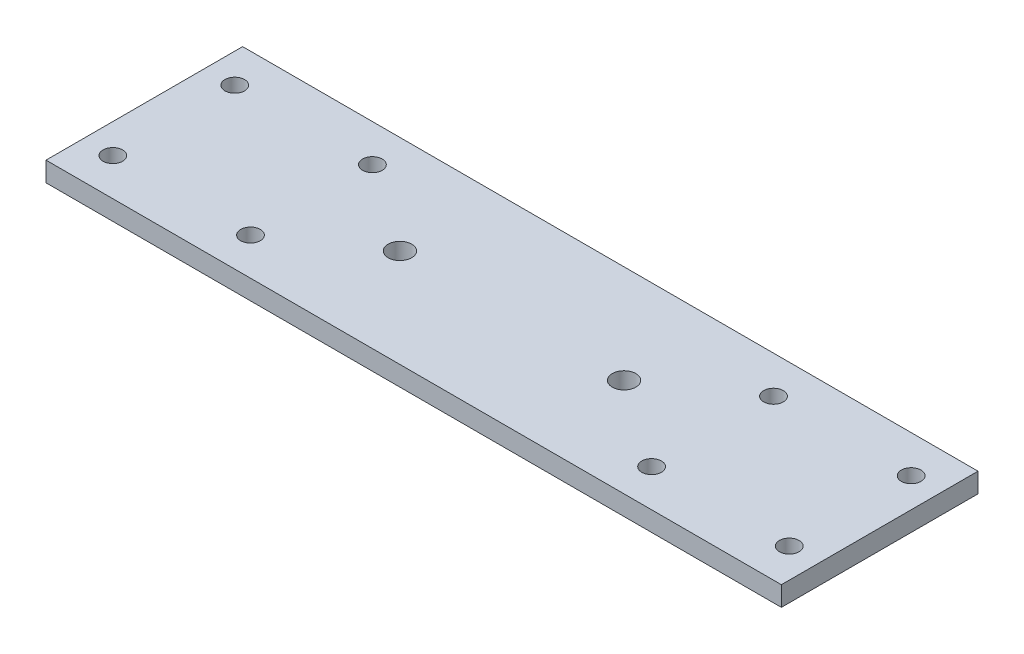
from build123d import *

# Parameters (mm, degrees)
SKETCH1_W           = 187
SKETCH1_H           = 50
BOSS_EXTRUDE1_DEPTH = 5
SKETCH2_R           = 3
CUT_EXTRUDE1_DEPTH  = 5
SKETCH3_R           = 2.5
CUT_EXTRUDE2_DEPTH  = 5
SKETCH4_R           = 2.5
CUT_EXTRUDE3_DEPTH  = 25
SKETCH5_R           = 2.5
CUT_EXTRUDE4_DEPTH  = 25


with BuildPart() as part:
    # Sketch1 → Boss-Extrude1 (new body)
    with BuildSketch(Plane(origin=(0, 0, 0), x_dir=(1, 0, 0), z_dir=(0, 1, 0))):
        with Locations((93.5, 25)):
            Rectangle(SKETCH1_W, SKETCH1_H)
    extrude(amount=BOSS_EXTRUDE1_DEPTH)

    # Sketch2 → Cut-Extrude1 (cut)
    with BuildSketch(Plane(origin=(0, 5, 0), x_dir=(1, 0, 0), z_dir=(0, 1, 0))):
        with Locations(Location((65, 25, 0), (0, 0, 270))):
            Circle(SKETCH2_R)
        with Locations(Location((122, 25, 0), (0, 0, 270))):
            Circle(SKETCH2_R)
    extrude(amount=-CUT_EXTRUDE1_DEPTH, mode=Mode.SUBTRACT)

    # Sketch3 → Cut-Extrude2 (cut)
    with BuildSketch(Plane(origin=(0, 5, 0), x_dir=(1, 0, 0), z_dir=(0, 1, 0))):
        with Locations(Location((144.5, 40.5, 0), (0, 0, 270))):
            Circle(SKETCH3_R)
        with Locations(Location((144.5, 9.5, 0), (0, 0, 270))):
            Circle(SKETCH3_R)
        with Locations(Location((179.5, 9.5, 0), (0, 0, 270))):
            Circle(SKETCH3_R)
        with Locations(Location((179.5, 40.5, 0), (0, 0, 270))):
            Circle(SKETCH3_R)
    extrude(amount=-CUT_EXTRUDE2_DEPTH, mode=Mode.SUBTRACT)

    # Sketch4 → Cut-Extrude3 (cut)
    with BuildSketch(Plane(origin=(0, 5, 0), x_dir=(1, 0, 0), z_dir=(0, 1, 0))):
        with Locations(Location((7.5, 40.5, 0), (0, 0, 270))):
            Circle(SKETCH4_R)
    extrude(amount=-CUT_EXTRUDE3_DEPTH, mode=Mode.SUBTRACT)

    # Sketch5 → Cut-Extrude4 (cut)
    with BuildSketch(Plane(origin=(0, 5, 0), x_dir=(1, 0, 0), z_dir=(0, 1, 0))):
        with Locations(Location((42.5, 9.5, 0), (0, 0, 270))):
            Circle(SKETCH5_R)
        with Locations(Location((7.5, 9.5, 0), (0, 0, 270))):
            Circle(SKETCH5_R)
        with Locations(Location((42.5, 40.5, 0), (0, 0, 270))):
            Circle(SKETCH5_R)
    extrude(amount=-CUT_EXTRUDE4_DEPTH, mode=Mode.SUBTRACT)


solid = part.part
